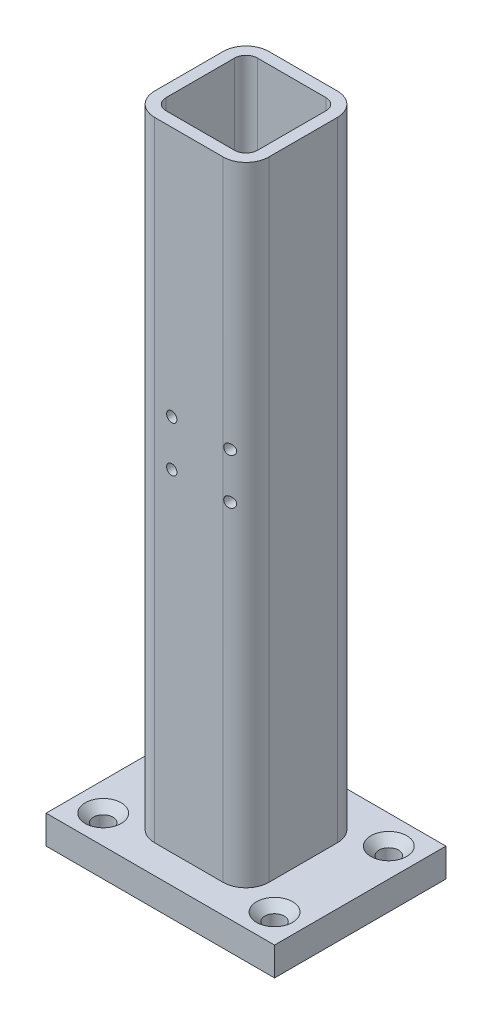
from build123d import *

# Parameters (mm, degrees)
SQUARE_TUBE_20_X_20_X_2_1_DEPTH                     = 110
SKETCH2_W                                           = 40
SKETCH2_H                                           = 30
BOSS_EXTRUDE1_DEPTH                                 = 5
CSK_FOR_M3_COUNTERSUNK_FLAT_HEAD_SCREW1_D           = 3.4
CSK_FOR_M3_COUNTERSUNK_FLAT_HEAD_SCREW1_DEPTH       = 30
CSK_FOR_M3_COUNTERSUNK_FLAT_HEAD_SCREW1_CSINK_D     = 6.3
CSK_FOR_M3_COUNTERSUNK_FLAT_HEAD_SCREW1_CSINK_ANGLE = 90
CSK_FOR_M3_COUNTERSUNK_FLAT_HEAD_SCREW1_TIP         = 1.021463052
SKETCH5_R                                           = 0.9
CUT_EXTRUDE1_DEPTH                                  = 5
CUT_EXTRUDE2_START                                  = -5
SKETCH6_R                                           = 0.9
CUT_EXTRUDE2_DEPTH                                  = 5


with BuildPart() as part:
    # Sketch1 → Square tube 20 X 20 X 2(1) (new body)
    with BuildSketch(Plane(origin=(0, 0, 0), x_dir=(1, 0, 0), z_dir=(0, 1, 0))):
        with BuildLine():
            Line((-6, -10), (6, -10))
            ThreePointArc((6, -10), (8.828427125, -8.828427125), (10, -6))
            Line((10, -6), (10, 6))
            ThreePointArc((10, 6), (8.828427125, 8.828427125), (6, 10))
            Line((6, 10), (-6, 10))
            ThreePointArc((-6, 10), (-8.828427125, 8.828427125), (-10, 6))
            Line((-10, 6), (-10, -6))
            ThreePointArc((-10, -6), (-8.828427125, -8.828427125), (-6, -10))
        make_face()
        with BuildLine():
            Line((-6, -8), (6, -8))
            ThreePointArc((6, -8), (7.414213562, -7.414213562), (8, -6))
            Line((8, -6), (8, 6))
            ThreePointArc((8, 6), (7.414213562, 7.414213562), (6, 8))
            Line((6, 8), (-6, 8))
            ThreePointArc((-6, 8), (-7.414213562, 7.414213562), (-8, 6))
            Line((-8, 6), (-8, -6))
            ThreePointArc((-8, -6), (-7.414213562, -7.414213562), (-6, -8))
        make_face(mode=Mode.SUBTRACT)
    extrude(amount=SQUARE_TUBE_20_X_20_X_2_1_DEPTH)

    # Sketch2 → Boss-Extrude1 (add)
    with BuildSketch(Plane(origin=(0, 0, 0), x_dir=(1, 0, 0), z_dir=(0, 1, 0))):
        Rectangle(SKETCH2_W, SKETCH2_H)
    extrude(amount=-BOSS_EXTRUDE1_DEPTH)

    # CSK for M3 Countersunk Flat Head Screw1
    with Locations(Plane(origin=(0, 0, 0), x_dir=(1, 0, 0), z_dir=(0, 1, 0))):
        with Locations((15, 10), (-15, 10), (-15, -10), (15, -10)):
            CounterSinkHole(CSK_FOR_M3_COUNTERSUNK_FLAT_HEAD_SCREW1_D / 2, CSK_FOR_M3_COUNTERSUNK_FLAT_HEAD_SCREW1_CSINK_D / 2, depth=CSK_FOR_M3_COUNTERSUNK_FLAT_HEAD_SCREW1_DEPTH, counter_sink_angle=CSK_FOR_M3_COUNTERSUNK_FLAT_HEAD_SCREW1_CSINK_ANGLE)
            with Locations((0, 0, -(CSK_FOR_M3_COUNTERSUNK_FLAT_HEAD_SCREW1_DEPTH + CSK_FOR_M3_COUNTERSUNK_FLAT_HEAD_SCREW1_TIP / 2))):  # 118° drill point
                Cone(0, CSK_FOR_M3_COUNTERSUNK_FLAT_HEAD_SCREW1_D / 2, CSK_FOR_M3_COUNTERSUNK_FLAT_HEAD_SCREW1_TIP, mode=Mode.SUBTRACT)

    # Sketch5 → Cut-Extrude1 (cut)
    with BuildSketch(Plane(origin=(0, 0, -10), x_dir=(-1, 0, 0), z_dir=(0, 0, -1))):
        with Locations((2.999999983, 66.1)):
            Circle(SKETCH5_R)
        with Locations((2.999999983, 58.1)):
            Circle(SKETCH5_R)
        with Locations((-7.000000017, 58.1)):
            Circle(SKETCH5_R)
        with Locations((-7.000000017, 66.1)):
            Circle(SKETCH5_R)
    extrude(amount=-CUT_EXTRUDE1_DEPTH, mode=Mode.SUBTRACT)

    # Sketch6 → Cut-Extrude2 (cut)
    with BuildSketch(Plane.XY.offset(10).offset(CUT_EXTRUDE2_START)):
        with Locations(Location((-2.999999994, 66.1, 0), (0, 0, 180))):
            Circle(SKETCH6_R)
        with Locations(Location((7.000000006, 66.1, 0), (0, 0, 180))):
            Circle(SKETCH6_R)
        with Locations(Location((7.000000006, 58.1, 0), (0, 0, 180))):
            Circle(SKETCH6_R)
        with Locations(Location((-2.999999994, 58.1, 0), (0, 0, 180))):
            Circle(SKETCH6_R)
    extrude(amount=CUT_EXTRUDE2_DEPTH, mode=Mode.SUBTRACT)


solid = part.part
